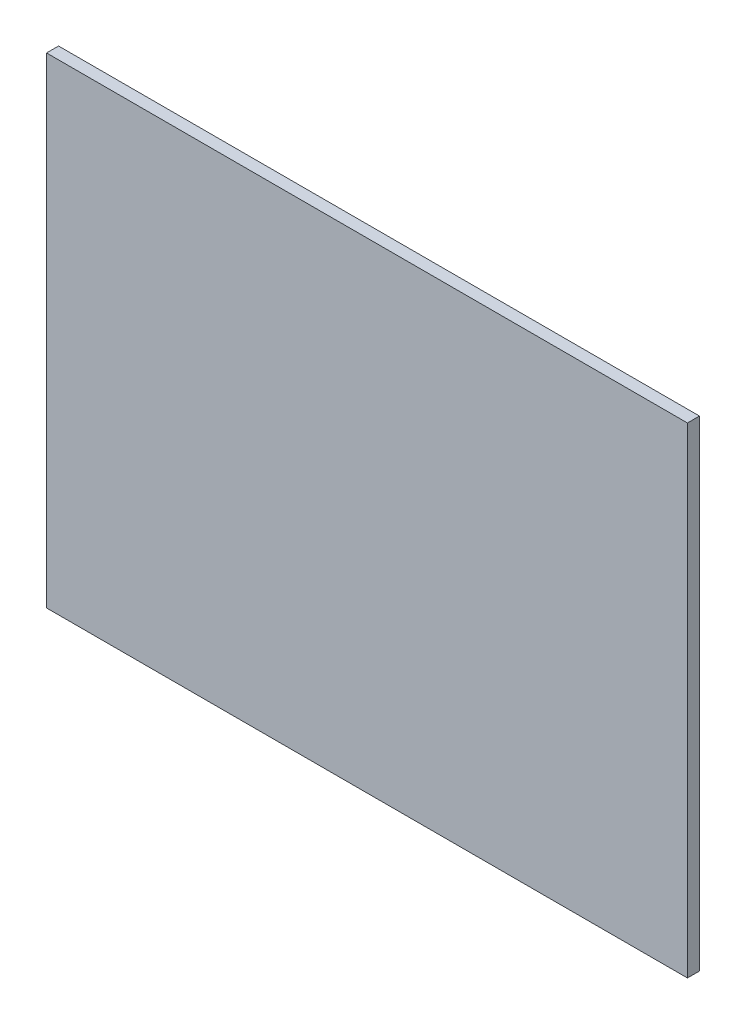
from build123d import *

# Parameters (mm, degrees)
SKETCH1_W           = 1016
SKETCH1_H           = 762
BOSS_EXTRUDE1_DEPTH = 19.05


with BuildPart() as part:
    # Sketch1 → Boss-Extrude1 (new body)
    with BuildSketch(Plane.XY):
        with Locations((508, 381)):
            Rectangle(SKETCH1_W, SKETCH1_H)
    extrude(amount=BOSS_EXTRUDE1_DEPTH)


solid = part.part
